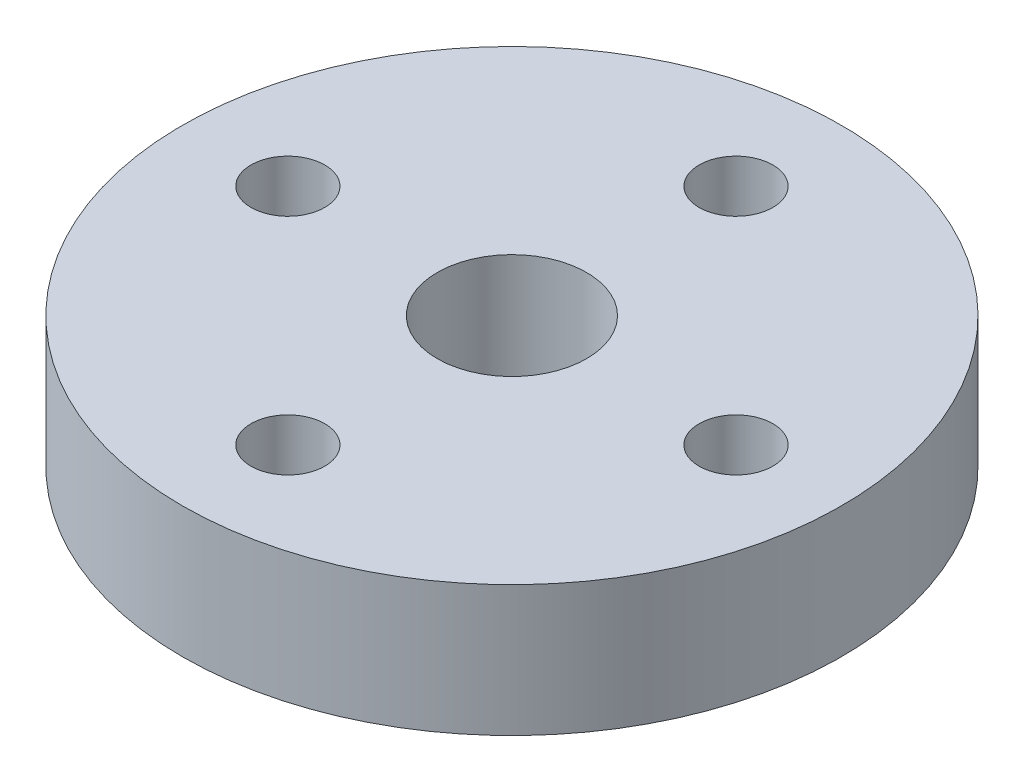
from build123d import *

# Parameters (mm, degrees)
SKETCH1_R           = 17.65
SKETCH1_R_2         = 4
SKETCH1_R_3         = 1.975
BOSS_EXTRUDE1_DEPTH = 7


with BuildPart() as part:
    # Sketch1 → Boss-Extrude1 (new body)
    with BuildSketch(Plane(origin=(0, 0, 0), x_dir=(1, 0, 0), z_dir=(0, 1, 0))):
        with Locations(Location((0, 0, 0), (0, 0, 270))):
            Circle(SKETCH1_R)
        with Locations(Location((0, 0, 0), (0, 0, 270))):
            Circle(SKETCH1_R_2, mode=Mode.SUBTRACT)
        with Locations(Location((0, 12, 0), (0, 0, 270))):
            Circle(SKETCH1_R_3, mode=Mode.SUBTRACT)
        with Locations(Location((12, 0, 0), (0, 0, 270))):
            Circle(SKETCH1_R_3, mode=Mode.SUBTRACT)
        with Locations(Location((0, -12, 0), (0, 0, 270))):
            Circle(SKETCH1_R_3, mode=Mode.SUBTRACT)
        with Locations(Location((-12, 0, 0), (0, 0, 270))):
            Circle(SKETCH1_R_3, mode=Mode.SUBTRACT)
    extrude(amount=BOSS_EXTRUDE1_DEPTH)


solid = part.part
